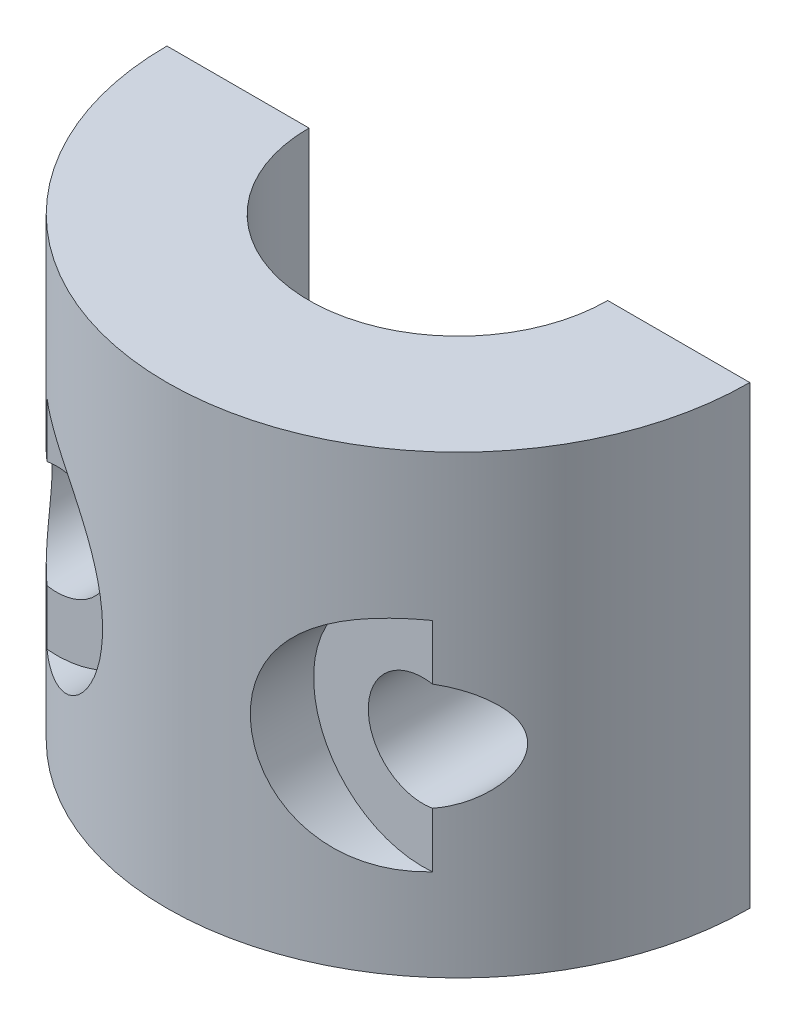
from build123d import *

# Parameters (mm, degrees)
BOSS_EXTRUDE2_START     = 5.5
SKETCH8_R               = 2
BOSS_EXTRUDE2_DEPTH     = 5.5
SKETCH9_R               = 2.05
CUT_EXTRUDE3_DEPTH      = 5.5
CUT_EXTRUDE4_DEPTH      = 5.5
CUT_EXTRUDE4_DEPTH_BACK = 3
SKETCH10_R              = 0.75
SKETCH12_R              = 2.032145481
CUT_EXTRUDE5_DEPTH      = 1.2
CUT_EXTRUDE11_START     = -3
SKETCH15_R              = 1.5
CUT_EXTRUDE11_DEPTH     = 21.2
CUT_EXTRUDE12_START     = 24.2
SKETCH16_R              = 1.5
CUT_EXTRUDE12_DEPTH     = 21.2
SKETCH17_W              = 12.094428853
SKETCH17_H              = 12.59473796
CUT_EXTRUDE14_DEPTH     = 21.2
SKETCH18_R              = 5.596164195
CUT_EXTRUDE15_DEPTH     = 0.75


with BuildPart() as part:
    # Sketch1 → Revolve2 (revolve)
    with BuildSketch(Plane.XY):
        Polygon((-0.75, -3.5), (-0.75, -2), (-2, -2), (-2, 3.5), (-4, 3.5), (-4, -3.5), align=None)
        Polygon((2, -2), (0.75, -2), (0.75, -3.5), (4, -3.5), (4, 3.5), (2, 3.5), align=None)
    revolve(axis=Axis((0, 0, 0), (0, -1, 0)))

    # Sketch8 → Boss-Extrude2 (add)
    with BuildSketch(Plane(origin=(0, -2, 0), x_dir=(1, 0, 0), z_dir=(0, 1, 0)).offset(BOSS_EXTRUDE2_START)):
        Circle(SKETCH8_R)
    extrude(amount=-BOSS_EXTRUDE2_DEPTH)

    # Sketch9 → Cut-Extrude3 (cut)
    with BuildSketch(Plane.XZ.offset(2)):
        Circle(SKETCH9_R)
    extrude(amount=-CUT_EXTRUDE3_DEPTH, mode=Mode.SUBTRACT)

    # Sketch10 → Cut-Extrude4 (cut, two sides: drawn at the far end of the back side and taken through both)
    with BuildSketch(Plane.XY.offset(-CUT_EXTRUDE4_DEPTH_BACK)):
        with Locations(Location((2.513623539, 0, 0), (0, 0, 180))):
            Circle(SKETCH10_R)
        with Locations(Location((-2.513623539, 0, 0), (0, 0, 180))):
            Circle(SKETCH10_R)
    extrude(amount=CUT_EXTRUDE4_DEPTH + CUT_EXTRUDE4_DEPTH_BACK, mode=Mode.SUBTRACT)

    # Sketch12 → Cut-Extrude5 (cut)
    with BuildSketch(Plane(origin=(0, -2, 0), x_dir=(1, 0, 0), z_dir=(0, 1, 0))):
        Circle(SKETCH12_R)
    extrude(amount=CUT_EXTRUDE5_DEPTH, mode=Mode.SUBTRACT)

    # Sketch15 → Cut-Extrude11 (cut)
    with BuildSketch(Plane.XY.offset(CUT_EXTRUDE11_START)):
        with Locations((2.513623539, 0)):
            Circle(SKETCH15_R)
        with Locations((-2.513623539, 0)):
            Circle(SKETCH15_R)
    extrude(amount=-CUT_EXTRUDE11_DEPTH, mode=Mode.SUBTRACT)

    # Sketch16 → Cut-Extrude12 (cut)
    with BuildSketch(Plane.XY.offset(CUT_EXTRUDE12_START)):
        with Locations((2.513623539, 0)):
            Circle(SKETCH16_R)
        with Locations((-2.513623539, 0)):
            Circle(SKETCH16_R)
    extrude(amount=-CUT_EXTRUDE12_DEPTH, mode=Mode.SUBTRACT)

    # Sketch17 → Cut-Extrude14 (cut)
    with BuildSketch(Plane.XY):
        with Locations((-0.435051398, -0.913607935)):
            Rectangle(SKETCH17_W, SKETCH17_H)
    extrude(amount=-CUT_EXTRUDE14_DEPTH, mode=Mode.SUBTRACT)

    # Sketch18 → Cut-Extrude15 (cut)
    with BuildSketch(Plane.XZ.offset(3.5)):
        Circle(SKETCH18_R)
    extrude(amount=-CUT_EXTRUDE15_DEPTH, mode=Mode.SUBTRACT)


solid = part.part
